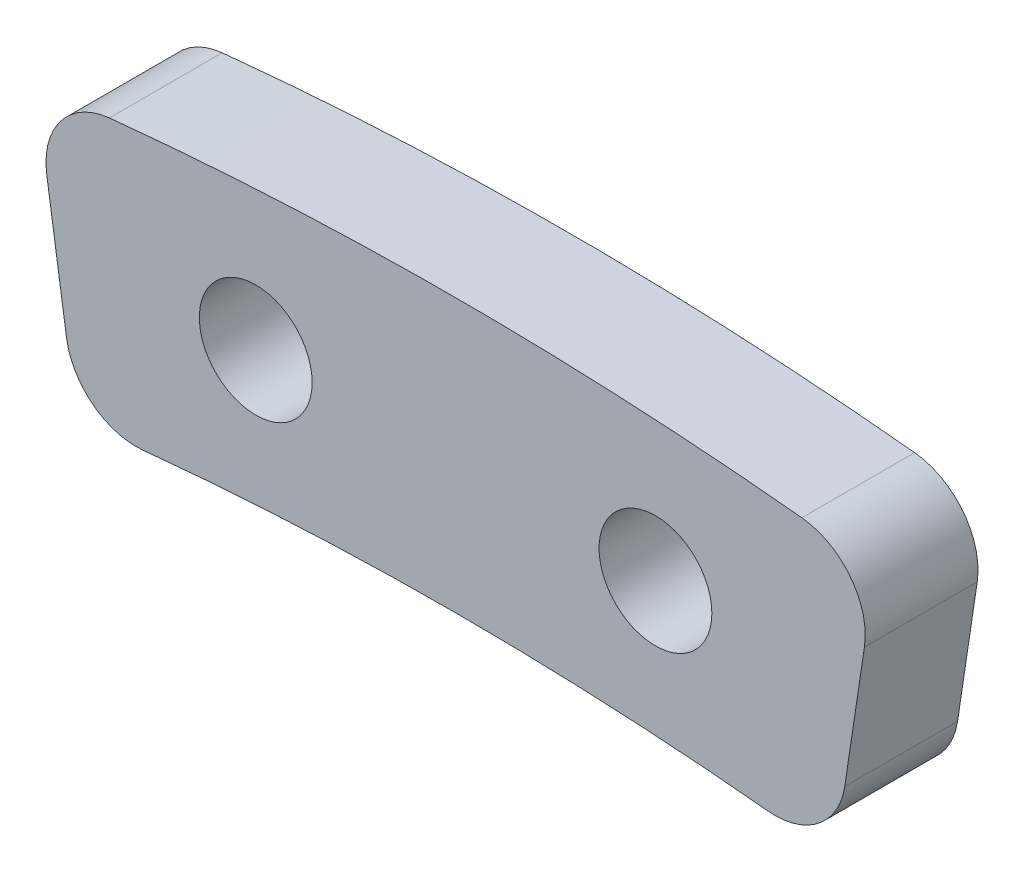
from build123d import *

# Parameters (mm, degrees)
BOSS_EXTRUDE1_DEPTH = 3.2
FILLET1_R           = 2
SKETCH2_R           = 1.6
CUT_EXTRUDE1_DEPTH  = 99.11525581


with BuildPart() as part:
    # Sketch1 → Boss-Extrude1 (new body)
    with BuildSketch(Plane.XY):
        with BuildLine():
            Line((-11.908609546, 96.641044089), (-10.753969279, 88.980506454))
            ThreePointArc((-10.753969279, 88.980506454), (0, 89.628), (10.753969279, 88.980506454))
            Line((10.753969279, 88.980506454), (11.908609546, 96.641044089))
            ThreePointArc((11.908609546, 96.641044089), (0, 97.372), (-11.908609546, 96.641044089))
        make_face()
    extrude(amount=BOSS_EXTRUDE1_DEPTH)

    # Fillet1
    fillet1_edges = [part.edges().sort_by_distance(p)[0] for p in [
        (11.908609546, 96.641044089, 1.6),
        (10.753969279, 88.980506454, 1.6),
        (-10.753969279, 88.980506454, 1.6),
        (-11.908609546, 96.641044089, 1.6),
    ]]
    fillet(fillet1_edges, radius=FILLET1_R)

    # Sketch2 → Cut-Extrude1 (cut, through all)
    with BuildSketch(Plane.XY.offset(3.2)):
        with Locations((-5.670312341, 93.250077468)):
            Circle(SKETCH2_R)
        with Locations((5.670312341, 93.250077468)):
            Circle(SKETCH2_R)
    extrude(amount=-CUT_EXTRUDE1_DEPTH, mode=Mode.SUBTRACT)


solid = part.part
